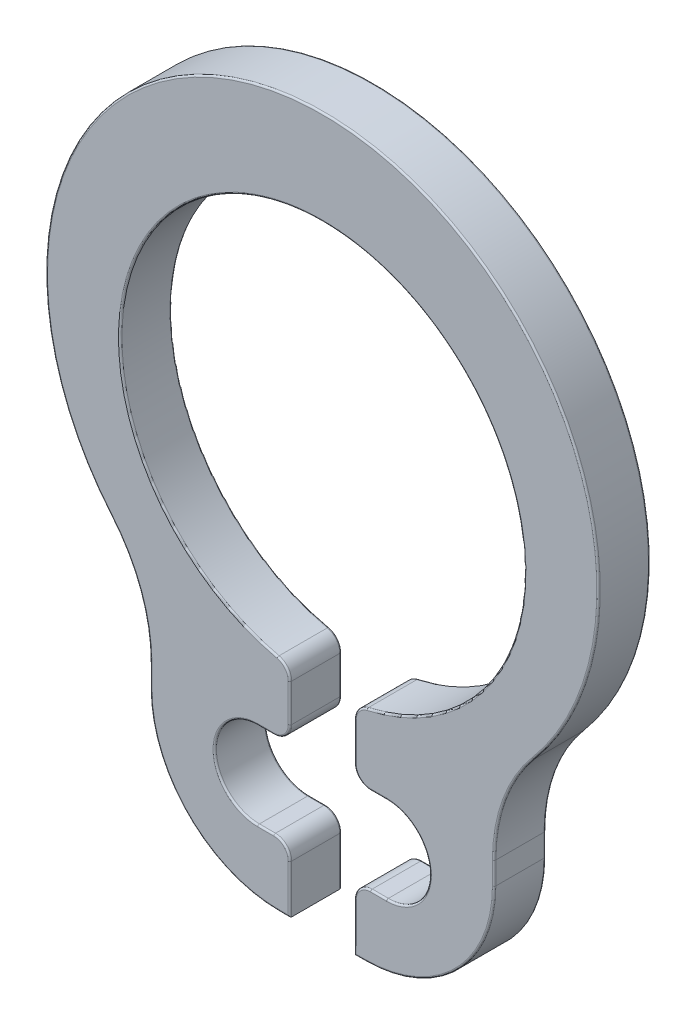
from build123d import *

# Parameters (mm, degrees)
SKETCH3_R                    = 2.35
BOSS_EXTRUDE1_DEPTH          = 0.3
CUT_EXTRUDE_THIN1_DEPTH      = 6.258205492
CUT_EXTRUDE_THIN1_DEPTH_BACK = 6.258205492
SKETCH4_W                    = 0.75
SKETCH4_H                    = 4.85
FILLET2_R                    = 0.1875
FILLET1_R                    = 0.02


with BuildPart() as part:
    # Sketch3 → Boss-Extrude1 (new, symmetric)
    with BuildSketch(Plane.XY):
        with BuildLine():
            Line((2, -2.388530559), (2, -2.65))
            ThreePointArc((2, -2.65), (1.560660172, -3.710660172), (0.5, -4.15))
            Line((0.5, -4.15), (-0.5, -4.15))
            ThreePointArc((-0.5, -4.15), (-1.560660172, -3.710660172), (-2, -2.65))
            Line((-2, -2.65), (-2, -2.388530559))
            ThreePointArc((-2, -2.388530559), (-2.117823629, -1.723075724), (-2.456968869, -1.138530559))
            ThreePointArc((-2.456968869, -1.138530559), (0, 4.15), (2.456968869, -1.138530559))
            ThreePointArc((2.456968869, -1.138530559), (2.117823629, -1.723075724), (2, -2.388530559))
        make_face()
        with Locations((0, 0.7)):
            Circle(SKETCH3_R, mode=Mode.SUBTRACT)
        with BuildLine():
            Line((-0.75, -3.4), (0.75, -3.4))
            ThreePointArc((0.75, -3.4), (1.25, -2.9), (0.75, -2.4))
            Line((0.75, -2.4), (-0.75, -2.4))
            ThreePointArc((-0.75, -2.4), (-1.25, -2.9), (-0.75, -3.4))
        make_face(mode=Mode.SUBTRACT)
    extrude(amount=BOSS_EXTRUDE1_DEPTH, both=True)

    # Sketch4 → Cut-Extrude-Thin1 (cut, two sides: drawn at the far end of the back side and taken through both)
    with BuildSketch(Plane.XY.offset(-CUT_EXTRUDE_THIN1_DEPTH_BACK)):
        with Locations((0, -1.725)):
            Rectangle(SKETCH4_W, SKETCH4_H)
    extrude(amount=CUT_EXTRUDE_THIN1_DEPTH + CUT_EXTRUDE_THIN1_DEPTH_BACK, mode=Mode.SUBTRACT)

    # Fillet2
    fillet2_edges = [part.edges().sort_by_distance(p)[0] for p in [
        (0.375, -1.619886851, 0),
        (-0.375, -1.619886851, 0),
        (-0.375, -3.4, 0),
        (-0.375, -2.4, 0),
        (0.375, -3.4, 0),
        (0.375, -2.4, 0),
    ]]
    fillet(fillet2_edges, radius=FILLET2_R)

    # Fillet1
    fillet1_edges = [part.edges().sort_by_distance(p)[0] for p in [
        (-1.560660172, -3.710660172, 0.3),
        (-2, -2.519265279, -0.3),
        (-2.117823629, -1.723075724, -0.3),
        (-0.4375, -4.15, 0.3),
        (1.560660172, -3.710660172, 0.3),
        (2, -2.519265279, 0.3),
        (2.117823629, -1.723075724, 0.3),
        (-1.25, -2.9, -0.3),
        (-0.65625, -3.4, -0.3),
        (1.25, -2.9, -0.3),
        (0.65625, -2.4, -0.3),
        (0, 4.15, 0.3),
        (-1.25, -2.9, 0.3),
        (-0.65625, -3.4, 0.3),
        (1.25, -2.9, 0.3),
        (0.65625, -2.4, 0.3),
        (-2.117823629, -1.723075724, 0.3),
        (0.4375, -4.15, -0.3),
        (0.4375, -4.15, 0.3),
        (-2, -2.519265279, 0.3),
        (0, 4.15, -0.3),
        (0.65625, -3.4, -0.3),
        (0.65625, -3.4, 0.3),
        (-0.375, -3.86875, 0.3),
        (-0.65625, -2.4, 0.3),
        (-0.375, -1.993434303, 0.3),
        (0, 3.05, 0.3),
        (0.375, -1.993434303, 0.3),
        (2.117823629, -1.723075724, -0.3),
        (0.375, -3.86875, 0.3),
        (-0.415957331, -1.657400678, 0.3),
        (-0.429917479, -2.345082521, 0.3),
        (0.415957331, -1.657400678, 0.3),
        (0.429917479, -2.345082521, 0.3),
        (-0.429917479, -3.454917479, 0.3),
        (0.429917479, -3.454917479, 0.3),
        (0.375, -3.86875, -0.3),
        (2, -2.519265279, -0.3),
        (-0.375, -3.86875, -0.3),
        (0.375, -1.993434303, -0.3),
        (0, 3.05, -0.3),
        (-0.375, -1.993434303, -0.3),
        (-0.65625, -2.4, -0.3),
        (-0.415957331, -1.657400678, -0.3),
        (-0.429917479, -2.345082521, -0.3),
        (1.560660172, -3.710660172, -0.3),
        (0.415957331, -1.657400678, -0.3),
        (0.429917479, -2.345082521, -0.3),
        (-0.429917479, -3.454917479, -0.3),
        (0.429917479, -3.454917479, -0.3),
        (-0.4375, -4.15, -0.3),
        (-1.560660172, -3.710660172, -0.3),
    ]]
    fillet(fillet1_edges, radius=FILLET1_R)


solid = part.part
